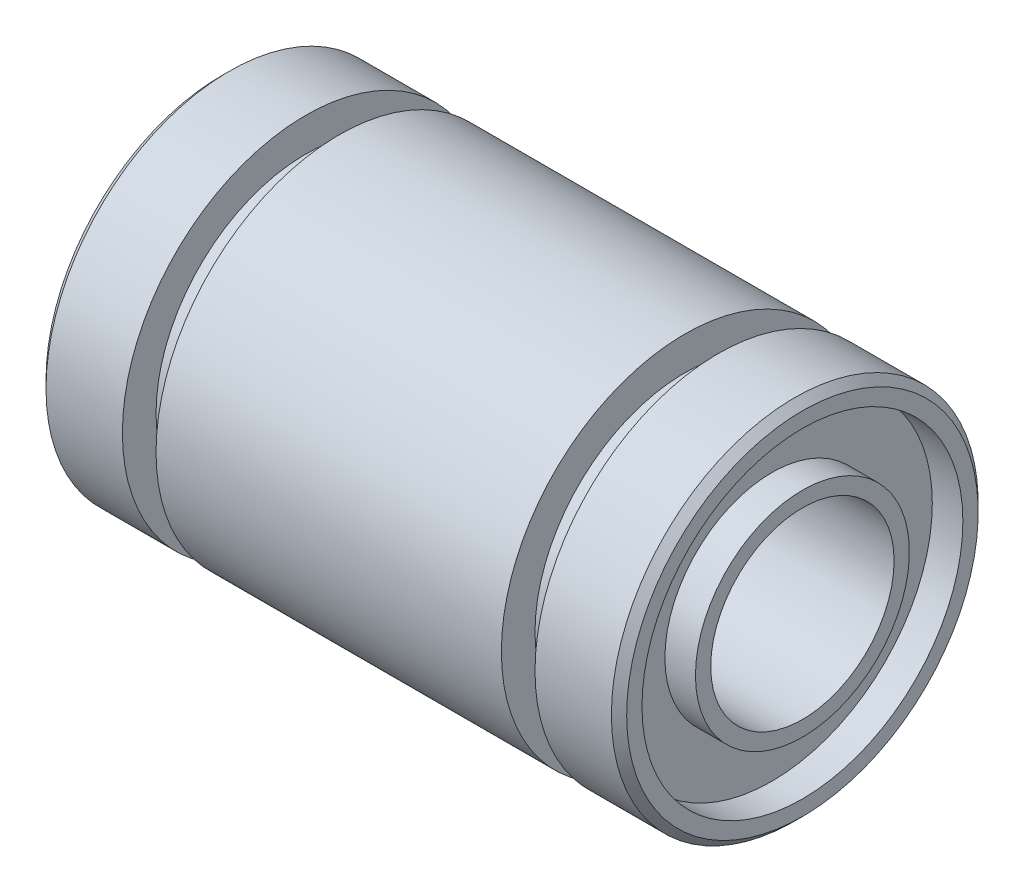
from build123d import *


with BuildPart() as part:
    # Sketch1 → Revolve1 (revolve)
    with BuildSketch(Plane.XY, mode=Mode.PRIVATE) as revolve1_sk:
        Polygon((9.25, 6), (9.5, 5.75), (9.5, 5.25), (8.5, 5.25), (8.5, 3.5), (9.5, 3.5), (9.5, 3), (-9.5, 3), (-9.5, 3.5), (-8.5, 3.5), (-8.5, 5.25), (-9.5, 5.25), (-9.5, 5.75), (-9.25, 6), (-6.75, 6), (-6.75, 4.9), (-5.65, 4.9), (-5.65, 6), (5.65, 6), (5.65, 4.9), (6.75, 4.9), (6.75, 6), align=None)
    revolve(revolve1_sk.sketch.rotate(Axis((-45.689505325, 0, 0), (1, 0, 0)), 90), axis=Axis((-45.689505325, 0, 0), (1, 0, 0)))


solid = part.part
